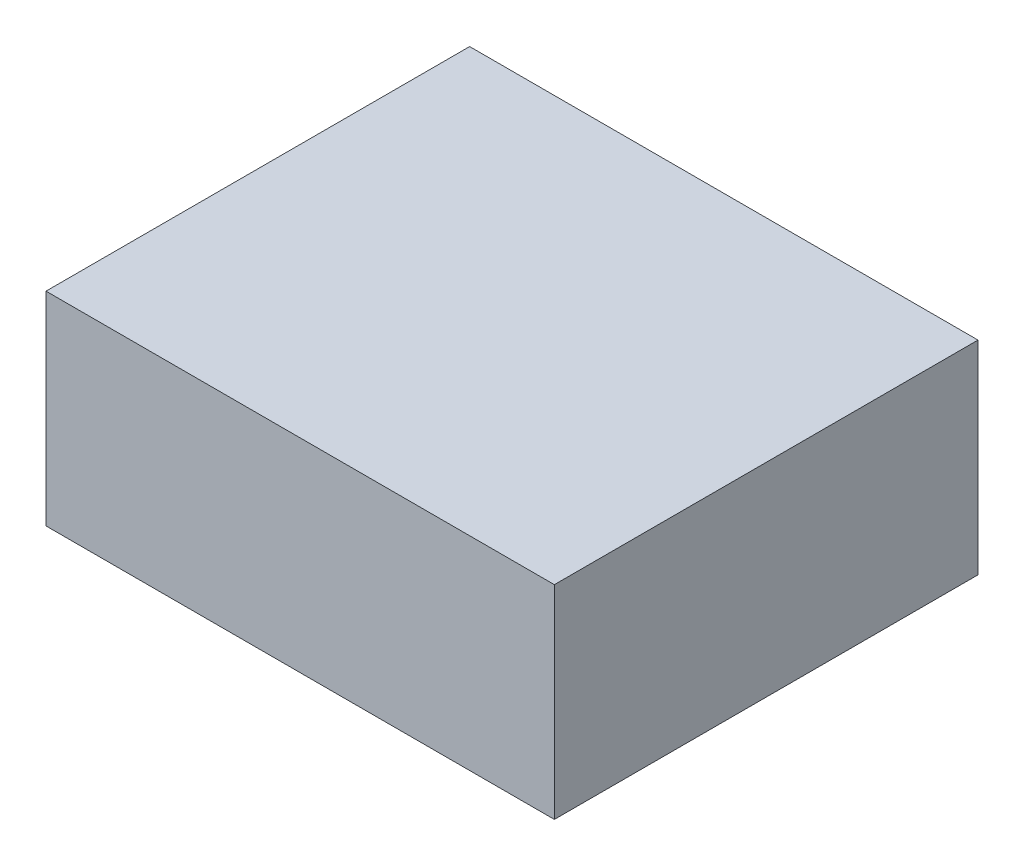
from build123d import *

# Parameters (mm, degrees)
SKETCH1_W           = 300
SKETCH1_H           = 250
BOSS_EXTRUDE1_DEPTH = 1.25
SKETCH5_W           = 300
SKETCH5_H           = 250
SKETCH5_W_2         = 297.5
SKETCH5_H_2         = 247.5
BOSS_EXTRUDE2_DEPTH = 120
SKETCH6_W           = 300
SKETCH6_H           = 250
BOSS_EXTRUDE3_DEPTH = 1.25


with BuildPart() as part:
    # Sketch1 → Boss-Extrude1 (new body)
    with BuildSketch(Plane(origin=(0, 0, 0), x_dir=(1, 0, 0), z_dir=(0, 1, 0))):
        Rectangle(SKETCH1_W, SKETCH1_H)
    extrude(amount=BOSS_EXTRUDE1_DEPTH)

    # Sketch5 → Boss-Extrude2 (add)
    with BuildSketch(Plane(origin=(0, 0, 0), x_dir=(1, 0, 0), z_dir=(0, 1, 0))):
        Rectangle(SKETCH5_W, SKETCH5_H)
        Rectangle(SKETCH5_W_2, SKETCH5_H_2, mode=Mode.SUBTRACT)
    extrude(amount=BOSS_EXTRUDE2_DEPTH)

    # Sketch6 → Boss-Extrude3 (add)
    with BuildSketch(Plane(origin=(0, 120, 0), x_dir=(1, 0, 0), z_dir=(0, 1, 0))):
        Rectangle(SKETCH6_W, SKETCH6_H)
    extrude(amount=-BOSS_EXTRUDE3_DEPTH)


solid = part.part
